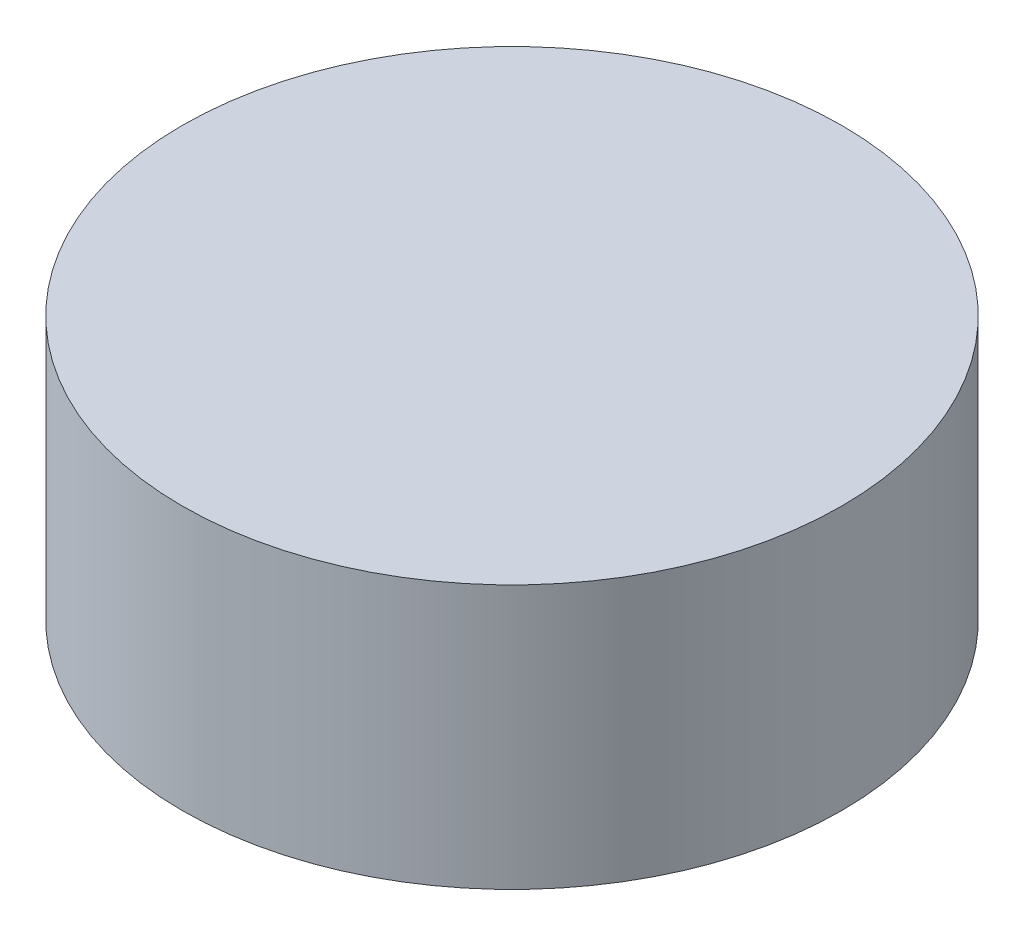
from build123d import *

# Parameters (mm, degrees)
SKETCH1_R           = 3.175
BOSS_EXTRUDE1_DEPTH = 2.54


with BuildPart() as part:
    # Sketch1 → Boss-Extrude1 (new body)
    with BuildSketch(Plane(origin=(0, 0, 0), x_dir=(1, 0, 0), z_dir=(0, 1, 0))):
        with Locations(Location((0, 0, 0), (0, 0, 270))):
            Circle(SKETCH1_R)
    extrude(amount=BOSS_EXTRUDE1_DEPTH)


solid = part.part
